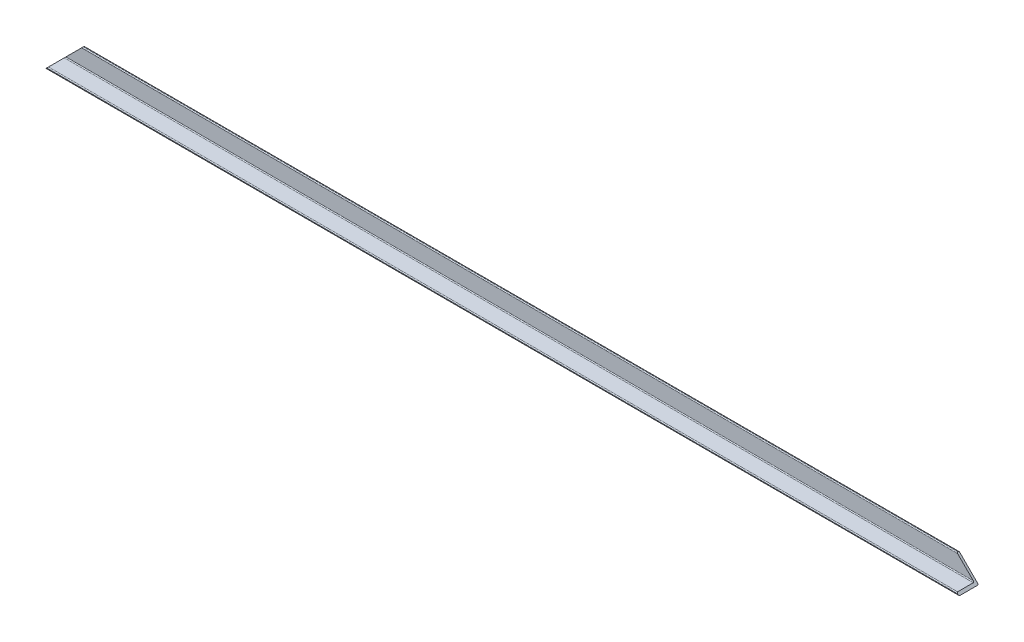
from build123d import *

# Parameters (mm, degrees)
SKETCH1_W               = 1065
SKETCH1_H               = 22.5
BOSS_EXTRUDE1_DEPTH     = 2.5
SKETCH2_W               = 1065
SKETCH2_H               = 2.5
BOSS_EXTRUDE2_DEPTH     = 20
CUT_EXTRUDE1_DEPTH      = 534.350260148
CUT_EXTRUDE1_DEPTH_BACK = 25
FILLET2_R               = 1


with BuildPart() as part:
    # Sketch1 → Boss-Extrude1 (new body)
    with BuildSketch(Plane(origin=(0, 0, 0), x_dir=(1, 0, 0), z_dir=(0, 1, 0))):
        Rectangle(SKETCH1_W, SKETCH1_H)
    extrude(amount=BOSS_EXTRUDE1_DEPTH)

    # Sketch2 → Boss-Extrude2 (add)
    with BuildSketch(Plane(origin=(0, 2.5, 0), x_dir=(1, 0, 0), z_dir=(0, 1, 0))):
        with Locations((0, 10)):
            Rectangle(SKETCH2_W, SKETCH2_H)
    extrude(amount=BOSS_EXTRUDE2_DEPTH)

    # Sketch3 → Cut-Extrude1 (cut, two sides: drawn at the far end of the back side and taken through both)
    with BuildSketch(Plane.XY.offset(-8.75).offset(-CUT_EXTRUDE1_DEPTH_BACK)):
        Polygon((-532.5, 22.5), (-532.5, -7.5), (-502.5, 22.5), align=None)
        Polygon((532.5, 22.5), (532.5, -7.5), (502.5, 22.5), align=None)
    extrude(amount=CUT_EXTRUDE1_DEPTH + CUT_EXTRUDE1_DEPTH_BACK, mode=Mode.SUBTRACT)

    # Fillet2
    fillet2_edges = [part.edges().sort_by_distance(p)[0] for p in [
        (0, 22.5, -8.75),
        (0, 2.5, -8.75),
        (0, 0, 11.25),
        (0, 2.5, 11.25),
        (0, 22.5, -11.25),
        (0, 0, -11.25),
    ]]
    fillet(fillet2_edges, radius=FILLET2_R)


solid = part.part
